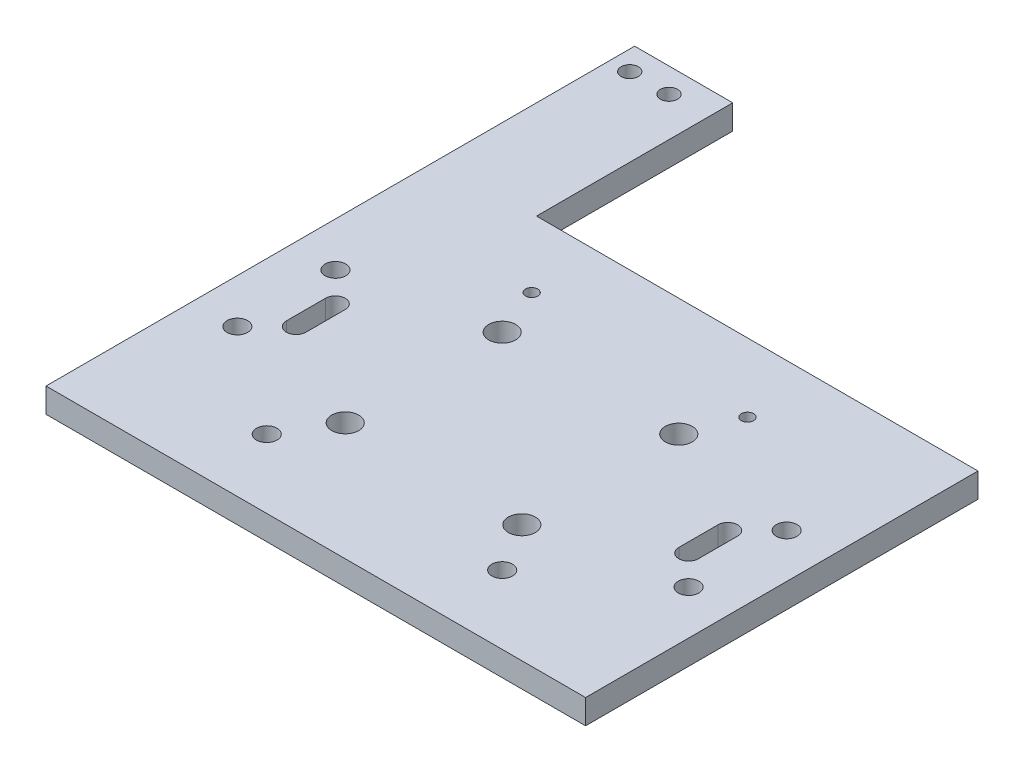
from build123d import *

# Parameters (mm, degrees)
SKETCH1_W           = 110
SKETCH1_H           = 80
SKETCH1_R           = 2.75
SKETCH1_R_2         = 1.25
SKETCH1_R_3         = 2.1
BOSS_EXTRUDE1_DEPTH = 5
SKETCH2_R           = 2.1
CUT_EXTRUDE1_DEPTH  = 69.190908485
SKETCH7_W           = 20
SKETCH7_H           = 40
BOSS_EXTRUDE2_DEPTH = 5
CUT_EXTRUDE2_REACH  = 99.211
SKETCH8_R           = 1.75


with BuildPart() as part:
    # Sketch1 → Boss-Extrude1 (new body)
    with BuildSketch(Plane(origin=(0, 0, 0), x_dir=(1, 0, 0), z_dir=(0, 1, 0))):
        Rectangle(SKETCH1_W, SKETCH1_H)
        with Locations(Location((-18, 16, 0), (0, 0, 270))):
            Circle(SKETCH1_R, mode=Mode.SUBTRACT)
        with Locations(Location((18, 16, 0), (0, 0, 270))):
            Circle(SKETCH1_R, mode=Mode.SUBTRACT)
        with Locations(Location((18, -16, 0), (0, 0, 270))):
            Circle(SKETCH1_R, mode=Mode.SUBTRACT)
        with Locations(Location((-18, -16, 0), (0, 0, 270))):
            Circle(SKETCH1_R, mode=Mode.SUBTRACT)
        with Locations(Location((-22, 26, 0), (0, 0, 270))):
            Circle(SKETCH1_R_2, mode=Mode.SUBTRACT)
        with Locations(Location((22, 26, 0), (0, 0, 270))):
            Circle(SKETCH1_R_2, mode=Mode.SUBTRACT)
        with Locations(Location((-24, -26, 0), (0, 0, 270))):
            Circle(SKETCH1_R_3, mode=Mode.SUBTRACT)
        with Locations(Location((24, -26, 0), (0, 0, 270))):
            Circle(SKETCH1_R_3, mode=Mode.SUBTRACT)
    extrude(amount=BOSS_EXTRUDE1_DEPTH)

    # Sketch2 → Cut-Extrude1 (cut, through all)
    with BuildSketch(Plane(origin=(0, 5, 0), x_dir=(1, 0, 0), z_dir=(0, 1, 0))):
        with Locations(Location((-46, 10, 0), (0, 0, 270))):
            Circle(SKETCH2_R)
        with Locations(Location((-46, -10, 0), (0, 0, 270))):
            Circle(SKETCH2_R)
        with Locations(Location((46, -10, 0), (0, 0, 270))):
            Circle(SKETCH2_R)
        with Locations(Location((46, 10, 0), (0, 0, 270))):
            Circle(SKETCH2_R)
        with BuildLine():
            Line((-38, 4), (-38, -4))
            ThreePointArc((-38, -4), (-40, -6), (-42, -4))
            Line((-42, -4), (-42, 4))
            ThreePointArc((-42, 4), (-40, 6), (-38, 4))
        make_face()
        with BuildLine():
            Line((42, 4), (42, -4))
            ThreePointArc((42, -4), (40, -6), (38, -4))
            Line((38, -4), (38, 4))
            ThreePointArc((38, 4), (40, 6), (42, 4))
        make_face()
    extrude(amount=-CUT_EXTRUDE1_DEPTH, mode=Mode.SUBTRACT)

    # Sketch7 → Boss-Extrude2 (add)
    with BuildSketch(Plane(origin=(0, 0, 0), x_dir=(1, 0, 0), z_dir=(0, 1, 0))):
        with Locations((-45, 60)):
            Rectangle(SKETCH7_W, SKETCH7_H)
    extrude(amount=BOSS_EXTRUDE2_DEPTH)

    # Sketch8 → Cut-Extrude2 (cut, up to next)
    with BuildSketch(Plane(origin=(0, 5, 0), x_dir=(1, 0, 0), z_dir=(0, 1, 0)), mode=Mode.PRIVATE) as cut_extrude2_sk1:
        with Locations(Location((-51, 75, 0), (0, 0, 270))):
            Circle(SKETCH8_R)
    cut_extrude2_tool1 = extrude(cut_extrude2_sk1.sketch, amount=-CUT_EXTRUDE2_REACH, mode=Mode.PRIVATE) & part.part
    # Sketch8 → Cut-Extrude2 (cut, up to next)
    with BuildSketch(Plane(origin=(0, 5, 0), x_dir=(1, 0, 0), z_dir=(0, 1, 0)), mode=Mode.PRIVATE) as cut_extrude2_sk2:
        with Locations(Location((-43, 75, 0), (0, 0, 270))):
            Circle(SKETCH8_R)
    cut_extrude2_tool2 = extrude(cut_extrude2_sk2.sketch, amount=-CUT_EXTRUDE2_REACH, mode=Mode.PRIVATE) & part.part
    add(cut_extrude2_tool1.solids().sort_by_distance((-51, 5, -75))[0], mode=Mode.SUBTRACT)
    add(cut_extrude2_tool2.solids().sort_by_distance((-43, 5, -75))[0], mode=Mode.SUBTRACT)


solid = part.part
